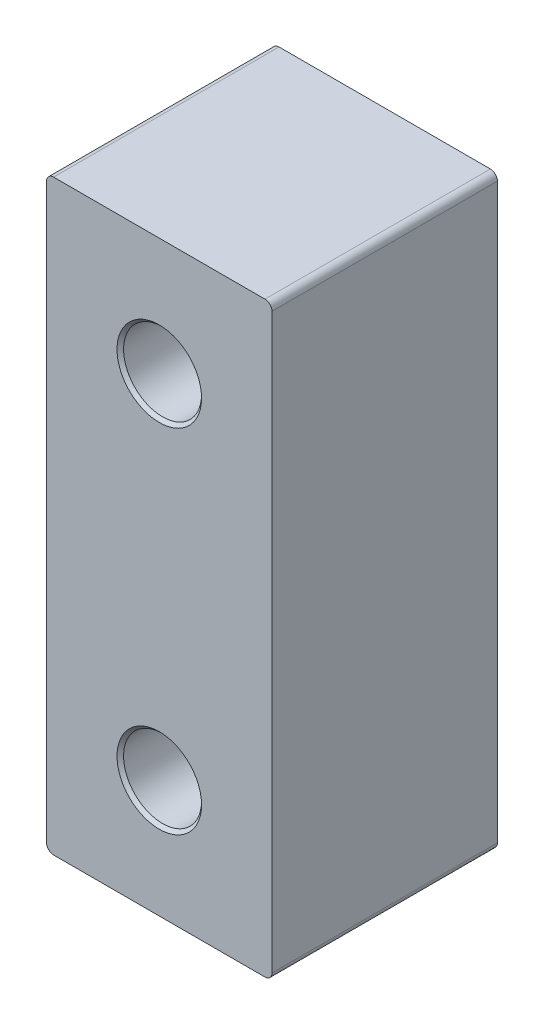
from build123d import *

# Parameters (mm, degrees)
SKETCH1_W                            = 12.192
SKETCH1_H                            = 31.75
BOSS_EXTRUDE1_DEPTH                  = 12.192
FILLET1_R                            = 0.381
F_19_0_166_DIAMETER_HOLE1_AT_2_COUNT = 2
F_19_0_166_DIAMETER_HOLE1_AT_2_PITCH = 19.05


with BuildPart() as part:
    # Sketch1 → Boss-Extrude1 (new body)
    with BuildSketch(Plane.XY):
        Rectangle(SKETCH1_W, SKETCH1_H)
    extrude(amount=BOSS_EXTRUDE1_DEPTH)

    # Fillet1
    fillet1_edges = [part.edges().sort_by_distance(p)[0] for p in [
        (-6.096, 15.875, 6.096),
        (6.096, 15.875, 6.096),
        (6.096, -15.875, 6.096),
        (-6.096, -15.875, 6.096),
    ]]
    fillet(fillet1_edges, radius=FILLET1_R)

    # Sketch2 → #19 (0.166) Diameter Hole1 (revolve, cut)
    with BuildSketch(Plane(origin=(0, 9.525, 12.192), x_dir=(0, -1, 0), z_dir=(1, 0, 0))):
        Polygon((0, 0), (0, 12.192), (2.286, 12.192), (2.1082, 12.0142), (2.1082, 0.1778), (2.286, 0), align=None)
    f_19_0_166_diameter_hole1 = revolve(axis=Axis((0, 9.525, 18.542), (0, 0, -1)), mode=Mode.SUBTRACT)

    # #19 (0.166) Diameter Hole1 at 2: #19 (0.166) Diameter Hole1 ×2
    with Locations(*[(0, -i * F_19_0_166_DIAMETER_HOLE1_AT_2_PITCH, 0) for i in range(1, F_19_0_166_DIAMETER_HOLE1_AT_2_COUNT)]):
        add(f_19_0_166_diameter_hole1, mode=Mode.SUBTRACT)


solid = part.part
